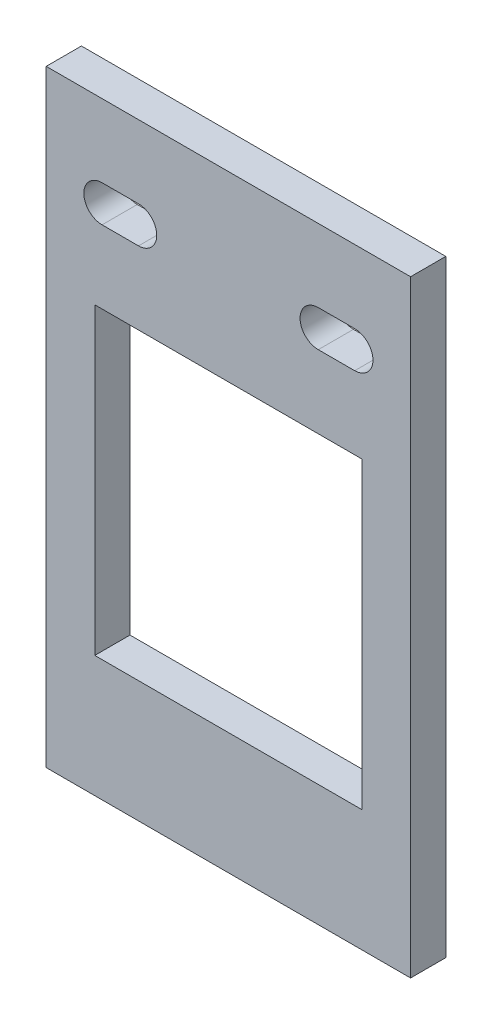
from build123d import *

# Parameters (mm, degrees)
SKETCH1_W           = 30
SKETCH1_H           = 50
SKETCH1_W_2         = 22
SKETCH1_H_2         = 25
BOSS_EXTRUDE1_DEPTH = 1.45


with BuildPart() as part:
    # Sketch1 → Boss-Extrude1 (new, symmetric)
    with BuildSketch(Plane.XY):
        with Locations((15, 25)):
            Rectangle(SKETCH1_W, SKETCH1_H)
        with BuildLine():
            Line((4.6, 44), (7.6, 44))
            ThreePointArc((7.6, 44), (9.1, 42.5), (7.6, 41))
            Line((7.6, 41), (4.6, 41))
            ThreePointArc((4.6, 41), (3.1, 42.5), (4.6, 44))
        make_face(mode=Mode.SUBTRACT)
        with BuildLine():
            Line((25.4, 44), (22.4, 44))
            ThreePointArc((22.4, 44), (20.9, 42.5), (22.4, 41))
            Line((22.4, 41), (25.4, 41))
            ThreePointArc((25.4, 41), (26.9, 42.5), (25.4, 44))
        make_face(mode=Mode.SUBTRACT)
        with Locations((15, 22.5)):
            Rectangle(SKETCH1_W_2, SKETCH1_H_2, mode=Mode.SUBTRACT)
    extrude(amount=BOSS_EXTRUDE1_DEPTH, both=True)


solid = part.part
